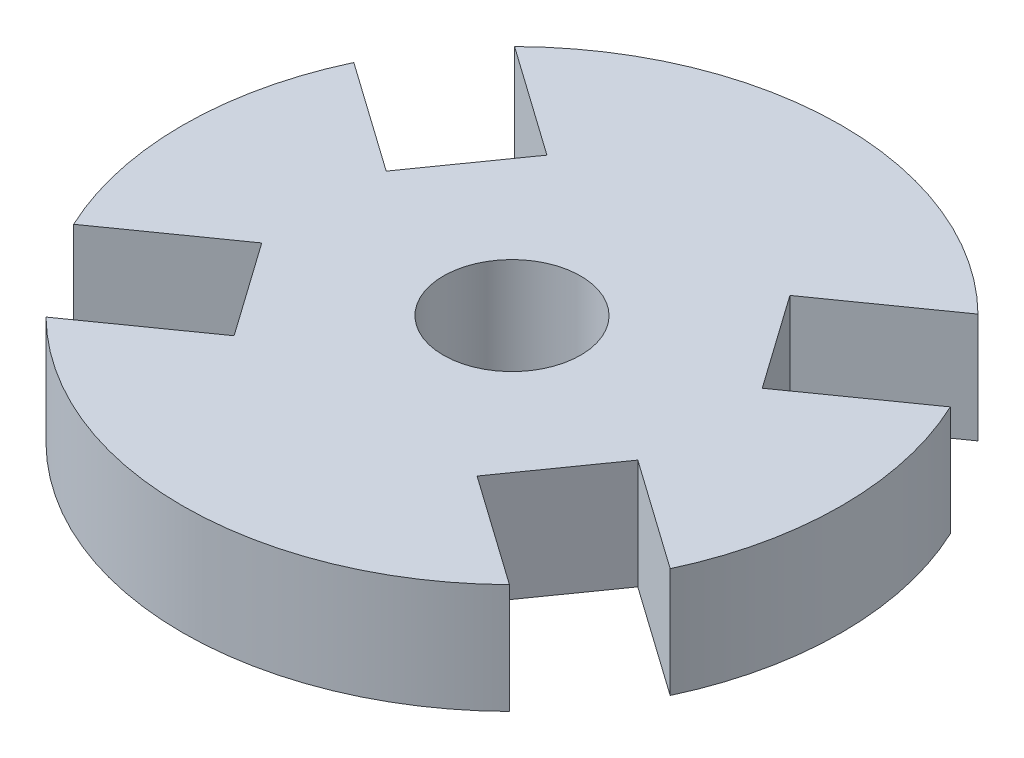
from build123d import *

# Parameters (mm, degrees)
CROQUIS1_R              = 12
CROQUIS1_R_2            = 2.5
SALIENTE_EXTRUIR1_DEPTH = 4
CORTAR_EXTRUIR1_DEPTH   = 4


with BuildPart() as part:
    # Croquis1 → Saliente-Extruir1 (new body)
    with BuildSketch(Plane(origin=(0, 0, 0), x_dir=(1, 0, 0), z_dir=(0, 1, 0))):
        with Locations(Location((0, 0, 0), (0, 0, 270))):
            Circle(CROQUIS1_R)
        with Locations(Location((0, 0, 0), (0, 0, 270))):
            Circle(CROQUIS1_R_2, mode=Mode.SUBTRACT)
    extrude(amount=SALIENTE_EXTRUIR1_DEPTH)

    # Croquis3 → Cortar-Extruir1 (cut)
    with BuildSketch(Plane(origin=(0, 4, 0), x_dir=(1, 0, 0), z_dir=(0, 1, 0))):
        Polygon((15.178438839, 8.150766492), (6.84734968, 2.265789565), (4.424123887, 5.696238042), (12.755213045, 11.581214969), align=None)
        Polygon((-4.424123887, -5.696238042), (-6.84734968, -2.265789565), (-15.178438839, -8.150766492), (-12.755213045, -11.581214969), align=None)
        Polygon((12.755213045, -11.581214969), (4.424123887, -5.696238042), (6.84734968, -2.265789565), (15.178438839, -8.150766492), align=None)
        Polygon((-6.84734968, 2.265789565), (-4.424123887, 5.696238042), (-12.755213045, 11.581214969), (-15.178438839, 8.150766492), align=None)
    extrude(amount=-CORTAR_EXTRUIR1_DEPTH, mode=Mode.SUBTRACT)


solid = part.part
